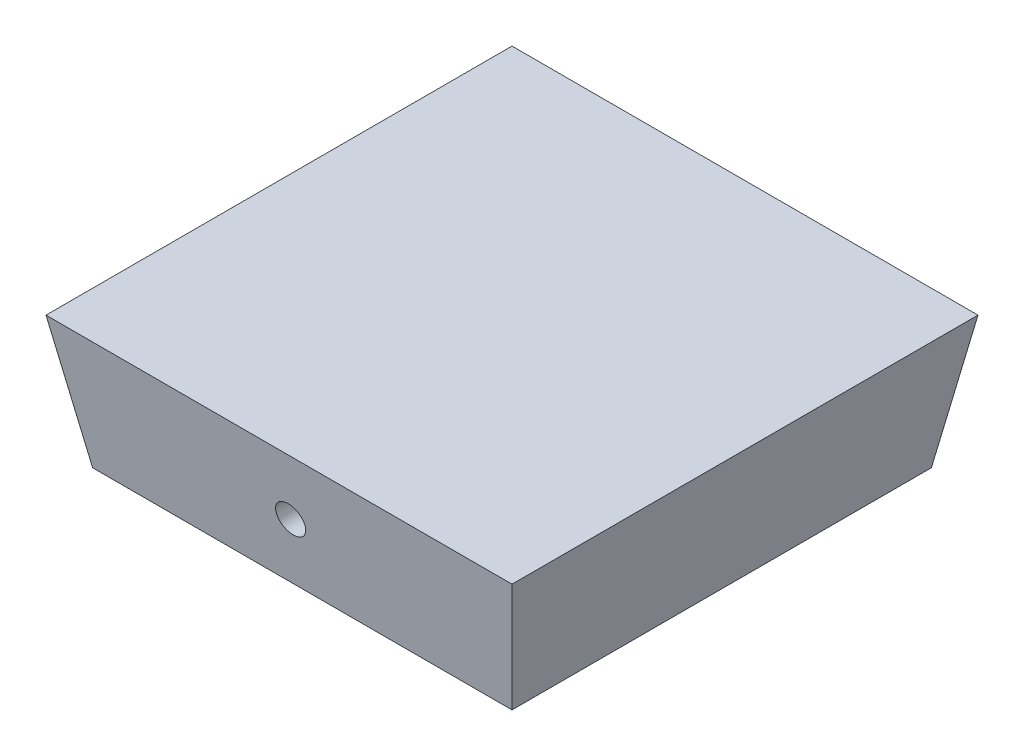
from build123d import *

# Parameters (mm, degrees)
ESQUISSE1_W             = 46.99
ESQUISSE1_H             = 46.99
BOSS_EXTRU_1_DEPTH      = 14.81582
BOSS_EXTRU_1_DRAFT      = -10
ESQUISSE4_R             = 1.666875
ENL_V_MAT_EXTRU_1_DEPTH = 12.7


with BuildPart() as part:
    # Esquisse1 → Boss.-Extru.1 (with draft: the straight prism first)
    with BuildSketch(Plane(origin=(0, 0, 0), x_dir=(1, 0, 0), z_dir=(0, 1, 0))):
        Rectangle(ESQUISSE1_W, ESQUISSE1_H)
    extrude(amount=BOSS_EXTRU_1_DEPTH)
    # Boss.-Extru.1: the draft: its side faces are tilted about the plane it starts from
    boss_extru_1_sides = [part.faces().sort_by_distance(p)[0] for p in [
        (0, 7.40791, 23.495),
        (23.495, 7.40791, 0),
        (0, 7.40791, -23.495),
        (-23.495, 7.40791, 0),
    ]]
    draft(boss_extru_1_sides, Plane(origin=(0, 0, 0), x_dir=(1, 0, 0), z_dir=(0, 1, 0)), BOSS_EXTRU_1_DRAFT)

    # Esquisse4 → Enlèv. mat.-Extru.1 (cut)
    with BuildSketch(Plane.XY.offset(26.67)):
        with Locations((0, 7.40791)):
            Circle(ESQUISSE4_R)
    extrude(amount=-ENL_V_MAT_EXTRU_1_DEPTH, mode=Mode.SUBTRACT)


solid = part.part
